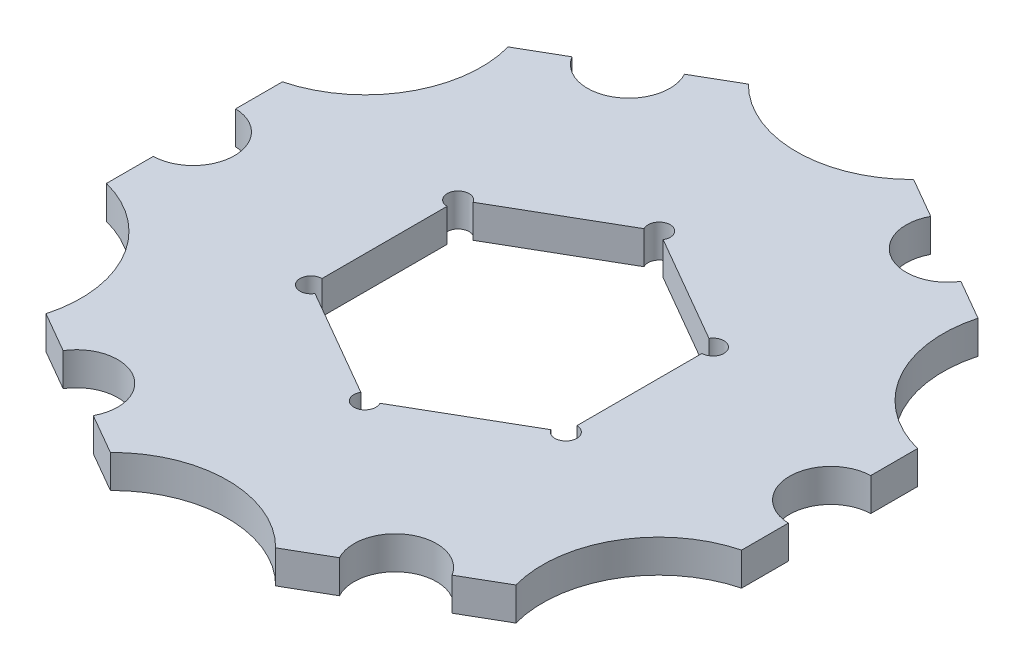
from build123d import *

# Parameters (mm, degrees)
BOSS_EXTRUDE1_DEPTH = 4.7625


with BuildPart() as part:
    # Sketch1 → Boss-Extrude1 (new body)
    with BuildSketch(Plane(origin=(0, 0, 0), x_dir=(1, 0, 0), z_dir=(0, 1, 0))):
        with BuildLine():
            ThreePointArc((-33.928372628, 33.36566521), (-35.574336427, 20.538852712), (-45.8597, 12.7))
            Line((-45.8597, 12.7), (-45.8597, 5.950469261))
            ThreePointArc((-45.8597, 5.950469261), (-40.084375, 0), (-45.8597, -5.950469261))
            Line((-45.8597, -5.950469261), (-45.8597, -12.7))
            ThreePointArc((-45.8597, -12.7), (-35.574336427, -20.538852712), (-33.928372628, -33.36566521))
            Line((-33.928372628, -33.36566521), (-28.083107544, -36.740430579))
            ThreePointArc((-28.083107544, -36.740430579), (-20.0421875, -34.714087045), (-17.776592456, -42.69089984))
            Line((-17.776592456, -42.69089984), (-11.931327372, -46.06566521))
            ThreePointArc((-11.931327372, -46.06566521), (0, -41.077705425), (11.931327372, -46.06566521))
            Line((11.931327372, -46.06566521), (17.776592456, -42.69089984))
            ThreePointArc((17.776592456, -42.69089984), (20.0421875, -34.714087045), (28.083107544, -36.740430579))
            Line((28.083107544, -36.740430579), (33.928372628, -33.36566521))
            ThreePointArc((33.928372628, -33.36566521), (35.574336427, -20.538852712), (45.8597, -12.7))
            Line((45.8597, -12.7), (45.8597, -5.950469261))
            ThreePointArc((45.8597, -5.950469261), (40.084375, 0), (45.8597, 5.950469261))
            Line((45.8597, 5.950469261), (45.8597, 12.7))
            ThreePointArc((45.8597, 12.7), (35.574336427, 20.538852712), (33.928372628, 33.36566521))
            Line((33.928372628, 33.36566521), (28.083107544, 36.740430579))
            ThreePointArc((28.083107544, 36.740430579), (20.0421875, 34.714087045), (17.776592456, 42.69089984))
            Line((17.776592456, 42.69089984), (11.931327372, 46.06566521))
            ThreePointArc((11.931327372, 46.06566521), (0, 41.077705425), (-11.931327372, 46.06566521))
            Line((-11.931327372, 46.06566521), (-17.776592456, 42.69089984))
            ThreePointArc((-17.776592456, 42.69089984), (-20.0421875, 34.714087045), (-28.083107544, 36.740430579))
            Line((-28.083107544, 36.740430579), (-33.928372628, 33.36566521))
        make_face()
        with BuildLine():
            Line((1.374815329, 20.455395717), (17.027484671, 11.418322859))
            ThreePointArc((17.027484671, 11.418322859), (18.813175234, 12.157980108), (19.9898, 10.624572859))
            ThreePointArc((19.9898, 10.624572859), (19.524832015, 9.502040844), (18.4023, 9.037072859))
            Line((18.4023, 9.037072859), (18.4023, -9.037072859))
            ThreePointArc((18.4023, -9.037072859), (19.524832015, -9.502040844), (19.9898, -10.624572859))
            ThreePointArc((19.9898, -10.624572859), (18.813175234, -12.157980108), (17.027484671, -11.418322859))
            Line((17.027484671, -11.418322859), (1.374815329, -20.455395717))
            ThreePointArc((1.374815329, -20.455395717), (1.533407249, -20.838270483), (1.5875, -21.249145717))
            ThreePointArc((1.5875, -21.249145717), (-0.410875234, -22.782552967), (-1.374815329, -20.455395717))
            Line((-1.374815329, -20.455395717), (-17.027484671, -11.418322859))
            ThreePointArc((-17.027484671, -11.418322859), (-19.777115329, -11.418322859), (-18.4023, -9.037072859))
            Line((-18.4023, -9.037072859), (-18.4023, 9.037072859))
            ThreePointArc((-18.4023, 9.037072859), (-19.777115329, 11.418322859), (-17.027484671, 11.418322859))
            Line((-17.027484671, 11.418322859), (-1.374815329, 20.455395717))
            ThreePointArc((-1.374815329, 20.455395717), (-0.410875234, 22.782552967), (1.5875, 21.249145717))
            ThreePointArc((1.5875, 21.249145717), (1.533407249, 20.838270483), (1.374815329, 20.455395717))
        make_face(mode=Mode.SUBTRACT)
    extrude(amount=BOSS_EXTRUDE1_DEPTH)


solid = part.part
